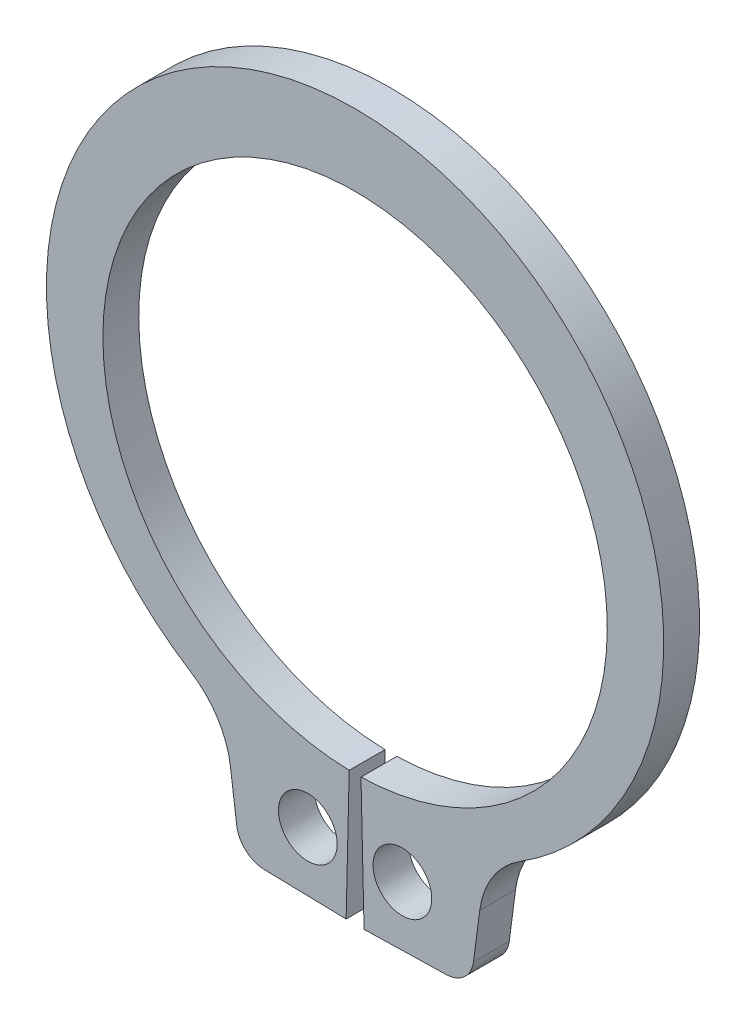
from build123d import *

# Parameters (mm, degrees)
BODYSKE_R  = 0.5207
BODY_DEPTH = 0.635


with BuildPart() as part:
    # BodySke → Body (new body)
    with BuildSketch(Plane.XY):
        with BuildLine():
            Line((0.104644195, -4.469175064), (0.15875, -6.779941716))
            Line((0.15875, -6.779941716), (1.614099102, -6.745865218))
            ThreePointArc((1.614099102, -6.745865218), (1.936445418, -6.618037579), (2.098117413, -6.31126532))
            Line((2.098117413, -6.31126532), (2.210013931, -5.461326879))
            ThreePointArc((2.210013931, -5.461326879), (2.439709478, -4.832900419), (2.914750444, -4.361714742))
            ThreePointArc((2.914750444, -4.361714742), (0, 5.7404), (-2.914750444, -4.361714742))
            ThreePointArc((-2.914750444, -4.361714742), (-2.439709478, -4.832900419), (-2.210013931, -5.461326879))
            Line((-2.210013931, -5.461326879), (-2.098117413, -6.31126532))
            ThreePointArc((-2.098117413, -6.31126532), (-1.936445418, -6.618037579), (-1.614099102, -6.745865218))
            Line((-1.614099102, -6.745865218), (-0.15875, -6.779941716))
            Line((-0.15875, -6.779941716), (-0.104644195, -4.469175064))
            ThreePointArc((-0.104644195, -4.469175064), (0, 4.4704), (0.104644195, -4.469175064))
        make_face()
        with Locations((0.8382, -5.710966327)):
            Circle(BODYSKE_R, mode=Mode.SUBTRACT)
        with Locations((-0.8382, -5.710966327)):
            Circle(BODYSKE_R, mode=Mode.SUBTRACT)
    extrude(amount=-BODY_DEPTH)


solid = part.part
